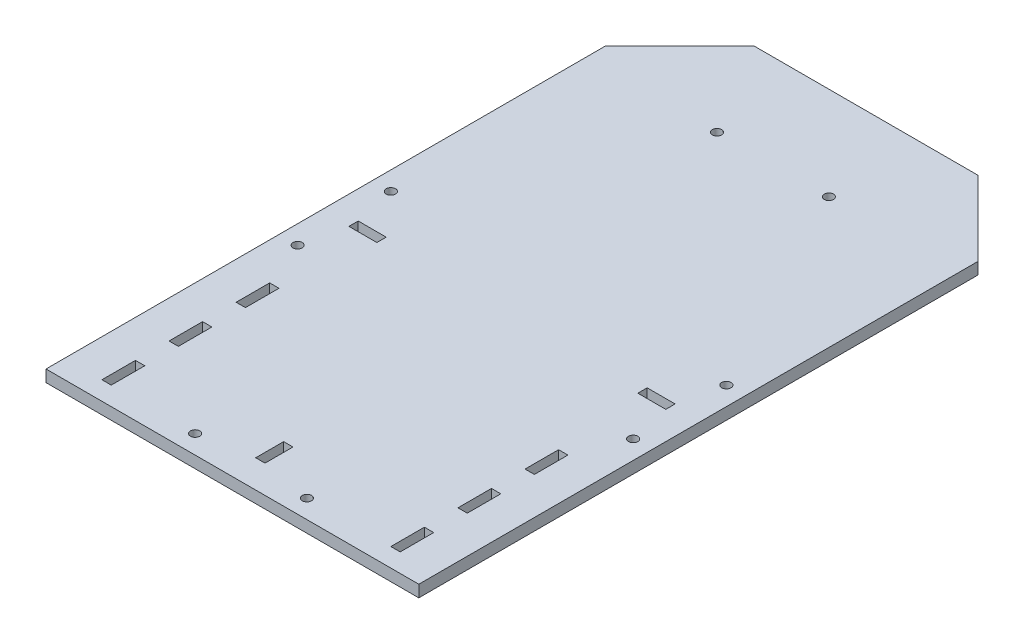
from build123d import *

# Parameters (mm, degrees)
BOSS_EXTRUDE1_DEPTH = 6.35
SKETCH2_R           = 2.5
SKETCH2_W           = 5
SKETCH2_H           = 15
SKETCH2_W_2         = 15
SKETCH2_H_2         = 5
CUT_EXTRUDE1_DEPTH  = 10
SKETCH3_W           = 5
SKETCH3_H           = 18
CUT_EXTRUDE2_DEPTH  = 10


with BuildPart() as part:
    # Sketch1 → Boss-Extrude1 (new body)
    with BuildSketch(Plane(origin=(0, 0, 0), x_dir=(1, 0, 0), z_dir=(0, 1, 0))):
        Polygon((-160, 340), (-200, 300), (-200, 0), (0, 0), (0, 300), (-40, 340), align=None)
    extrude(amount=BOSS_EXTRUDE1_DEPTH)

    # Sketch2 → Cut-Extrude1 (cut)
    with BuildSketch(Plane.XZ):
        with Locations((-190, -125)):
            Circle(SKETCH2_R)
        with Locations((-130, -10)):
            Circle(SKETCH2_R)
        with Locations((-70, -10)):
            Circle(SKETCH2_R)
        with Locations((-10, -125)):
            Circle(SKETCH2_R)
        with Locations((-70, -290)):
            Circle(SKETCH2_R)
        with Locations((-10, -175)):
            Circle(SKETCH2_R)
        with Locations((-130, -290)):
            Circle(SKETCH2_R)
        with Locations((-190, -175)):
            Circle(SKETCH2_R)
        with Locations((-100, -22.5)):
            Rectangle(SKETCH2_W, SKETCH2_H)
        with Locations((-177.5, -150)):
            Rectangle(SKETCH2_W_2, SKETCH2_H_2)
        with Locations((-22.5, -150)):
            Rectangle(SKETCH2_W_2, SKETCH2_H_2)
    extrude(amount=-CUT_EXTRUDE1_DEPTH, mode=Mode.SUBTRACT)

    # Sketch3 → Cut-Extrude2 (cut)
    with BuildSketch(Plane.XZ):
        with Locations((-177.5, -19)):
            Rectangle(SKETCH3_W, SKETCH3_H)
        with Locations((-177.5, -55)):
            Rectangle(SKETCH3_W, SKETCH3_H)
        with Locations((-177.5, -91)):
            Rectangle(SKETCH3_W, SKETCH3_H)
        with Locations((-22.5, -19)):
            Rectangle(SKETCH3_W, SKETCH3_H)
        with Locations((-22.5, -55)):
            Rectangle(SKETCH3_W, SKETCH3_H)
        with Locations((-22.5, -91)):
            Rectangle(SKETCH3_W, SKETCH3_H)
    extrude(amount=-CUT_EXTRUDE2_DEPTH, mode=Mode.SUBTRACT)


solid = part.part
